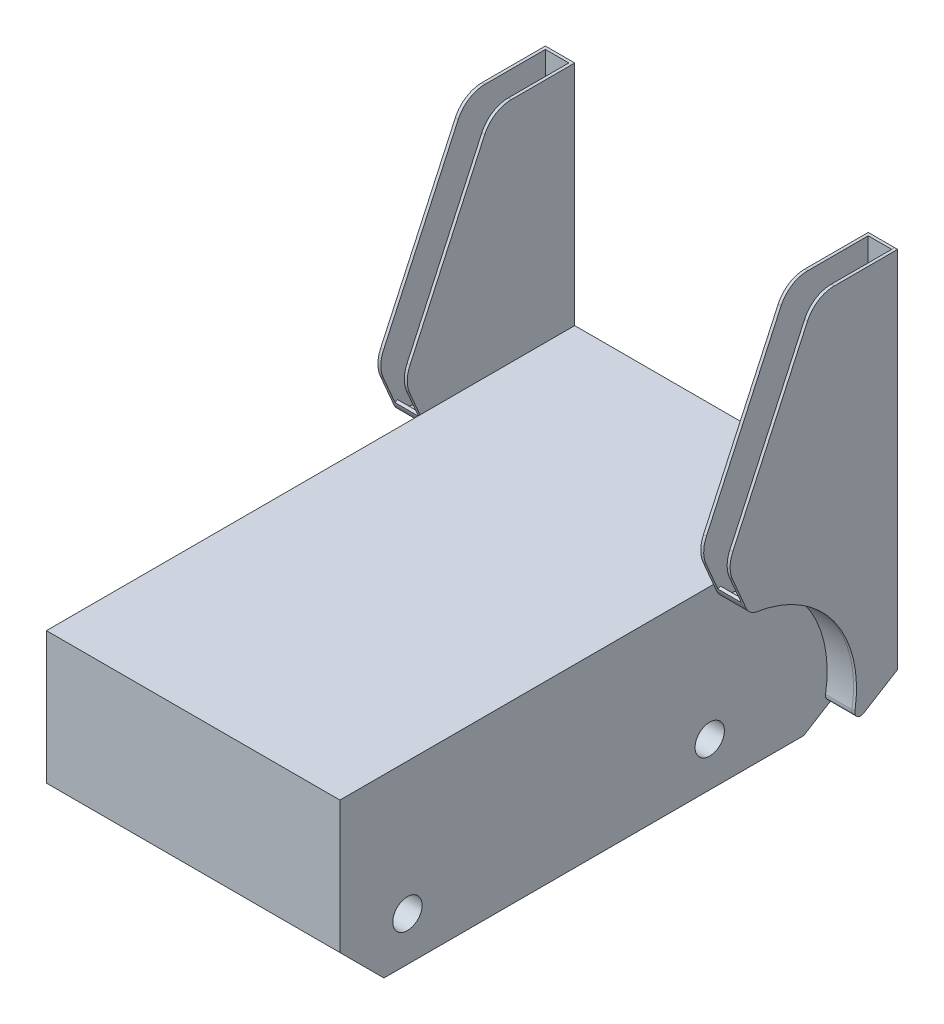
from build123d import *

# Parameters (mm, degrees)
SKETCH2_R           = 50
BOSS_EXTRUDE1_DEPTH = 500
BOSS_EXTRUDE2_DEPTH = 10
BOSS_EXTRUDE3_DEPTH = 80
BOSS_EXTRUDE4_START = 90
BOSS_EXTRUDE4_DEPTH = 10


with BuildPart() as part:
    # Sketch2 → Boss-Extrude1 (new, symmetric)
    with BuildSketch(Plane(origin=(0, 0, 0), x_dir=(0, 0, -1), z_dir=(1, 0, 0))):
        Polygon((-750, 0), (680, 0), (900, 135), (900, 600), (-900, 600), (-900, 150), align=None)
        with Locations((-670, 150)):
            Circle(SKETCH2_R, mode=Mode.SUBTRACT)
        with Locations((360, 150)):
            Circle(SKETCH2_R, mode=Mode.SUBTRACT)
    extrude(amount=BOSS_EXTRUDE1_DEPTH, both=True)


with BuildPart() as body_2:
    # Sketch3 → Boss-Extrude2 (new body)
    with BuildSketch(Plane(origin=(500, 0, 0), x_dir=(0, 0, -1), z_dir=(1, 0, 0))):
        with BuildLine():
            Line((900, 135), (900, 1375))
            Line((900, 1375), (684.046420048, 1375))
            ThreePointArc((684.046420048, 1375), (630.113322029, 1359.20938747), (593.212957077, 1316.824418761))
            Line((593.212957077, 1316.824418761), (338.587493201, 763.833765708))
            ThreePointArc((338.587493201, 763.833765708), (329.429813626, 723.340291143), (337.50645317, 682.617417089))
            Line((337.50645317, 682.617417089), (383.67812534, 574.883515358))
            ThreePointArc((383.67812534, 574.883515358), (398.954375956, 555.099407026), (421.898112747, 545.181760255))
            ThreePointArc((421.898112747, 545.181760255), (684.23633033, 384.245175178), (754.622739752, 84.632628396))
            ThreePointArc((754.622739752, 84.632628396), (763.188752403, 64.770887689), (784.814201137, 64.317805243))
            Line((784.814201137, 64.317805243), (900, 135))
        make_face()
    boss_extrude2 = extrude(amount=BOSS_EXTRUDE2_DEPTH)

    # Sketch4 → Boss-Extrude3 (add)
    with BuildSketch(Plane(origin=(510, 0, 0), x_dir=(0, 0, -1), z_dir=(1, 0, 0))):
        with BuildLine():
            Line((377.628203351, 589), (386.819653651, 592.939192986))
            Line((386.819653651, 592.939192986), (392.86957564, 578.822708344))
            ThreePointArc((392.86957564, 578.822708344), (405.090576133, 562.995421678), (423.445565566, 555.061304261))
            ThreePointArc((423.445565566, 555.061304261), (692.342238588, 390.101304558), (764.488308246, 82.998444106))
            ThreePointArc((764.488308246, 82.998444106), (768.771314571, 73.067573753), (779.584038938, 72.84103253))
            Line((779.584038938, 72.84103253), (890, 140.596281363))
            Line((890, 140.596281363), (890, 1375))
            Line((890, 1375), (900, 1375))
            Line((900, 1375), (900, 135))
            Line((900, 135), (784.814201137, 64.317805243))
            ThreePointArc((784.814201137, 64.317805243), (763.188752403, 64.770887689), (754.622739752, 84.632628396))
            ThreePointArc((754.622739752, 84.632628396), (684.23633033, 384.245175178), (421.898112747, 545.181760255))
            ThreePointArc((421.898112747, 545.181760255), (398.954375956, 555.099407026), (383.67812534, 574.883515358))
            Line((383.67812534, 574.883515358), (377.628203351, 589))
        make_face()
    boss_extrude3 = extrude(amount=BOSS_EXTRUDE3_DEPTH)


with BuildPart() as body_3:
    # Sketch3<2> → Boss-Extrude4 (new body)
    with BuildSketch(Plane(origin=(500, 0, 0), x_dir=(0, 0, -1), z_dir=(1, 0, 0)).offset(BOSS_EXTRUDE4_START)):
        with BuildLine():
            Line((900, 135), (900, 1375))
            Line((900, 1375), (684.046420048, 1375))
            ThreePointArc((684.046420048, 1375), (630.113322029, 1359.20938747), (593.212957077, 1316.824418761))
            Line((593.212957077, 1316.824418761), (338.587493201, 763.833765708))
            ThreePointArc((338.587493201, 763.833765708), (329.429813626, 723.340291143), (337.50645317, 682.617417089))
            Line((337.50645317, 682.617417089), (383.67812534, 574.883515358))
            ThreePointArc((383.67812534, 574.883515358), (398.954375956, 555.099407026), (421.898112747, 545.181760255))
            ThreePointArc((421.898112747, 545.181760255), (684.23633033, 384.245175178), (754.622739752, 84.632628396))
            ThreePointArc((754.622739752, 84.632628396), (763.188752403, 64.770887689), (784.814201137, 64.317805243))
            Line((784.814201137, 64.317805243), (900, 135))
        make_face()
    boss_extrude4 = extrude(amount=BOSS_EXTRUDE4_DEPTH)


with BuildPart() as part_1:
    add(part.part)

    # Mirror1: Boss-Extrude2, Boss-Extrude3, Boss-Extrude4 across plane
    add(boss_extrude2.mirror(Plane(origin=(0, 0, 0), x_dir=(0, 0, 1), z_dir=(1, 0, 0))))
    add(boss_extrude3.mirror(Plane(origin=(0, 0, 0), x_dir=(0, 0, 1), z_dir=(1, 0, 0))))
    add(boss_extrude4.mirror(Plane(origin=(0, 0, 0), x_dir=(0, 0, 1), z_dir=(1, 0, 0))))


solid = Compound([body_2.part, body_3.part, part_1.part])
